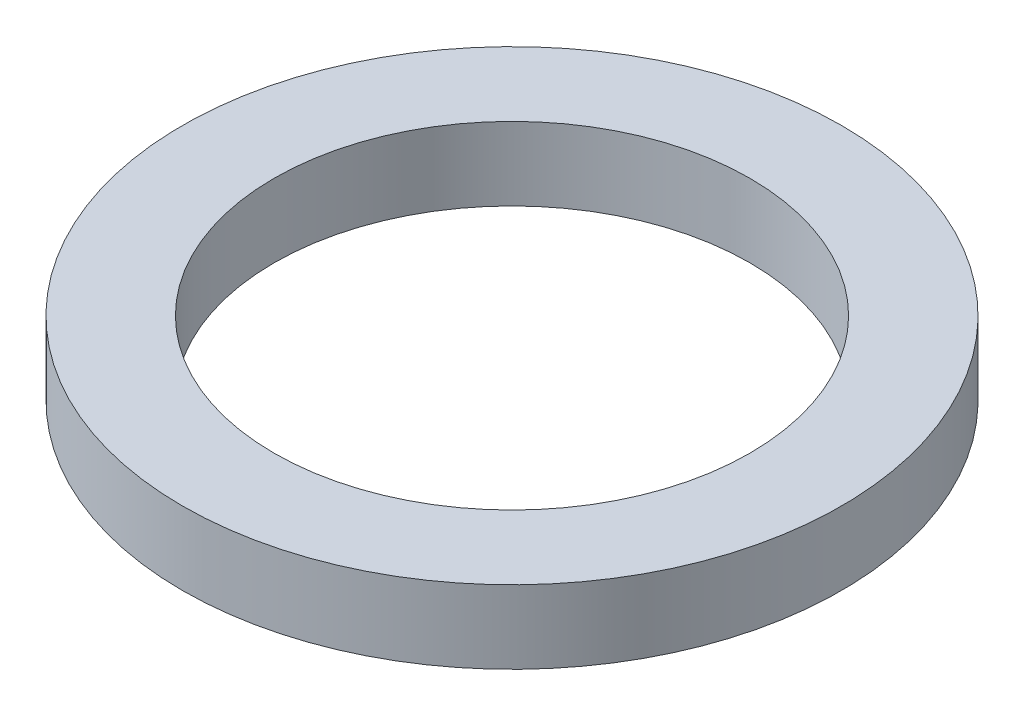
from build123d import *

# Parameters (mm, degrees)
SKETCH_1_R      = 4.5
SKETCH_1_R_2    = 3.25
EXTRUDE_1_DEPTH = 1


with BuildPart() as part:
    # 草图1 → 凸台-拉伸1 (new body)
    with BuildSketch(Plane(origin=(0, 0, 0), x_dir=(1, 0, 0), z_dir=(0, 1, 0))):
        with Locations(Location((0, 0, 0), (0, 0, 270))):
            Circle(SKETCH_1_R)
        with Locations(Location((0, 0, 0), (0, 0, 270))):
            Circle(SKETCH_1_R_2, mode=Mode.SUBTRACT)
    extrude(amount=EXTRUDE_1_DEPTH)


solid = part.part
